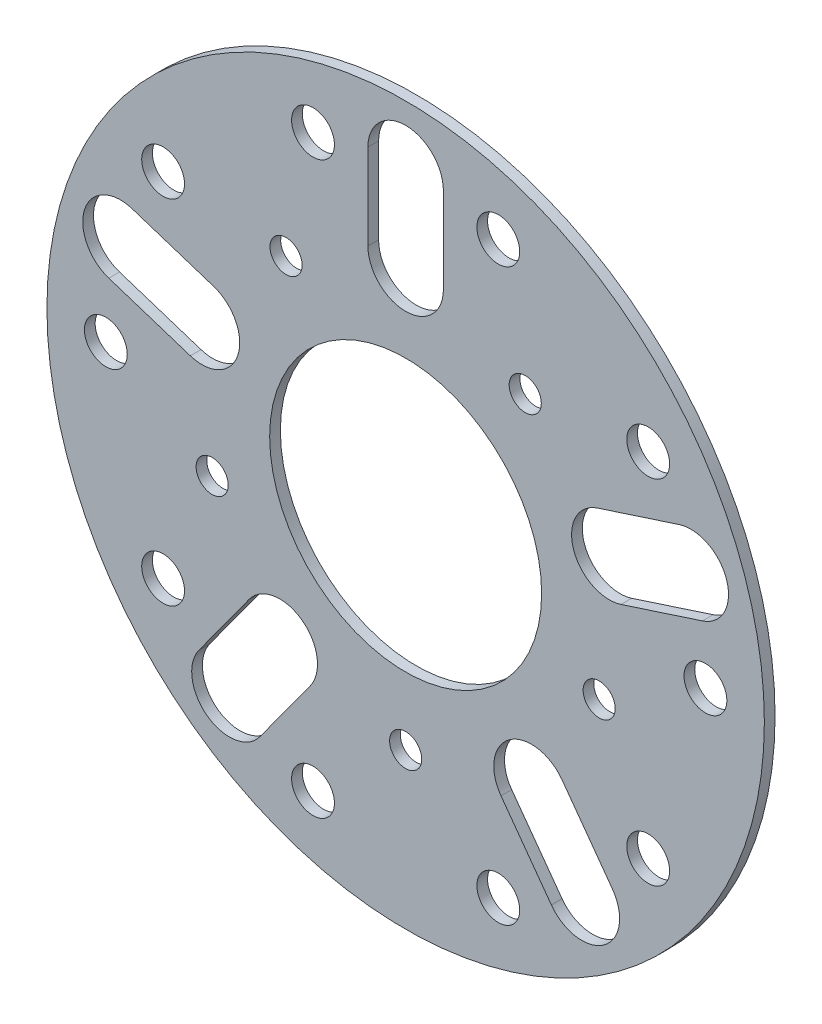
from build123d import *

# Parameters (mm, degrees)
SKETCH_1_R      = 33.5
SKETCH_1_R_2    = 12.7
SKETCH_1_R_3    = 1.5
SKETCH_1_R_4    = 2
EXTRUDE_1_DEPTH = 1


with BuildPart() as part:
    # 草图1 → 凸台-拉伸1 (new body)
    with BuildSketch(Plane.XY):
        Circle(SKETCH_1_R)
        Circle(SKETCH_1_R_2, mode=Mode.SUBTRACT)
        with Locations((0, -19)):
            Circle(SKETCH_1_R_3, mode=Mode.SUBTRACT)
        with Locations((-18.07007381, -5.871322893)):
            Circle(SKETCH_1_R_3, mode=Mode.SUBTRACT)
        with Locations((-11.167919794, 15.371322893)):
            Circle(SKETCH_1_R_3, mode=Mode.SUBTRACT)
        with Locations((11.167919794, 15.371322893)):
            Circle(SKETCH_1_R_3, mode=Mode.SUBTRACT)
        with Locations((18.07007381, -5.871322893)):
            Circle(SKETCH_1_R_3, mode=Mode.SUBTRACT)
        with Locations((-8.651773631, -26.627421273)):
            Circle(SKETCH_1_R_4, mode=Mode.SUBTRACT)
        with Locations(Location((8.651773631, -26.627421273, 0), (0, 0, 180))):
            Circle(SKETCH_1_R_4, mode=Mode.SUBTRACT)
        with Locations((-27.997727597, 0)):
            Circle(SKETCH_1_R_4, mode=Mode.SUBTRACT)
        with Locations(Location((-22.65063743, -16.456651379, 0), (0, 0, 180))):
            Circle(SKETCH_1_R_4, mode=Mode.SUBTRACT)
        with Locations((-8.651773631, 26.627421273)):
            Circle(SKETCH_1_R_4, mode=Mode.SUBTRACT)
        with Locations(Location((-22.65063743, 16.456651379, 0), (0, 0, 180))):
            Circle(SKETCH_1_R_4, mode=Mode.SUBTRACT)
        with Locations((22.65063743, 16.456651379)):
            Circle(SKETCH_1_R_4, mode=Mode.SUBTRACT)
        with Locations(Location((8.651773631, 26.627421273, 0), (0, 0, 180))):
            Circle(SKETCH_1_R_4, mode=Mode.SUBTRACT)
        with Locations((22.65063743, -16.456651379)):
            Circle(SKETCH_1_R_4, mode=Mode.SUBTRACT)
        with Locations(Location((27.997727597, 0, 0), (0, 0, 180))):
            Circle(SKETCH_1_R_4, mode=Mode.SUBTRACT)
        with BuildLine():
            Line((-19.308819678, -20.581224709), (-14.606537659, -14.109088754))
            ThreePointArc((-14.606537659, -14.109088754), (-9.684453912, -13.329507274), (-8.904872432, -18.251591021))
            Line((-8.904872432, -18.251591021), (-13.607154451, -24.723726976))
            ThreePointArc((-13.607154451, -24.723726976), (-18.529238198, -25.503308456), (-19.308819678, -20.581224709))
        make_face(mode=Mode.SUBTRACT)
        with BuildLine():
            Line((-25.540661294, 12.003830576), (-17.932209164, 9.531694621))
            ThreePointArc((-17.932209164, 9.531694621), (-15.669775592, 5.091418725), (-20.110051488, 2.828985154))
            Line((-20.110051488, 2.828985154), (-27.718503618, 5.301121109))
            ThreePointArc((-27.718503618, 5.301121109), (-29.98093719, 9.741397005), (-25.540661294, 12.003830576))
        make_face(mode=Mode.SUBTRACT)
        with BuildLine():
            Line((3.523822903, 28), (3.523822903, 20))
            ThreePointArc((3.523822903, 20), (0, 16.476177097), (-3.523822903, 20))
            Line((-3.523822903, 20), (-3.523822903, 28))
            ThreePointArc((-3.523822903, 28), (0, 31.523822903), (3.523822903, 28))
        make_face(mode=Mode.SUBTRACT)
        with BuildLine():
            Line((27.718503618, 5.301121109), (20.110051488, 2.828985154))
            ThreePointArc((20.110051488, 2.828985154), (15.669775592, 5.091418725), (17.932209164, 9.531694621))
            Line((17.932209164, 9.531694621), (25.540661294, 12.003830576))
            ThreePointArc((25.540661294, 12.003830576), (29.98093719, 9.741397005), (27.718503618, 5.301121109))
        make_face(mode=Mode.SUBTRACT)
        with BuildLine():
            Line((13.607154451, -24.723726976), (8.904872432, -18.251591021))
            ThreePointArc((8.904872432, -18.251591021), (9.684453912, -13.329507274), (14.606537659, -14.109088754))
            Line((14.606537659, -14.109088754), (19.308819678, -20.581224709))
            ThreePointArc((19.308819678, -20.581224709), (18.529238198, -25.503308456), (13.607154451, -24.723726976))
        make_face(mode=Mode.SUBTRACT)
    extrude(amount=EXTRUDE_1_DEPTH)


solid = part.part
